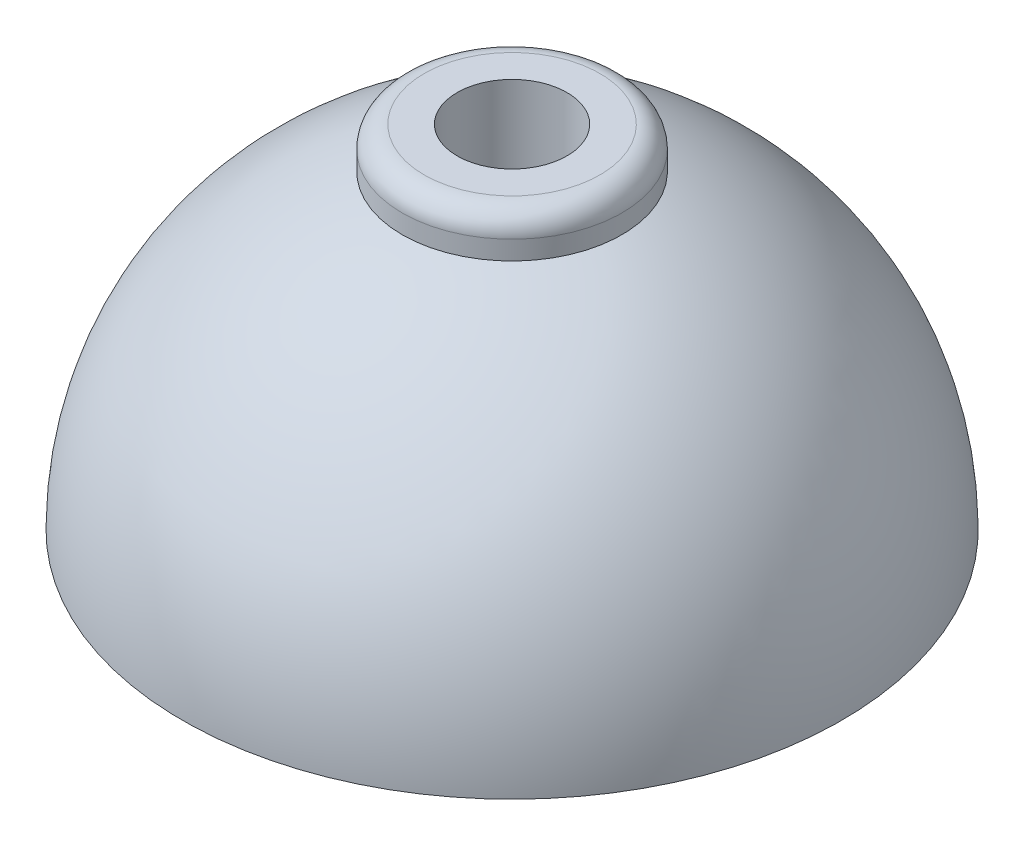
from build123d import *

# Parameters (mm, degrees)
SHELL1_T                 = -2
BOSS_EXTRUDE6_DEPTH      = 1
BOSS_EXTRUDE6_DEPTH_BACK = 5
SKETCH4_R                = 5
SKETCH2_R                = 2.5
CUT_EXTRUDE3_DEPTH       = 27.570660511
FILLET1_R                = 1


with BuildPart() as part:
    # Sketch1 → Revolve1 (revolve)
    with BuildSketch(Plane.XY):
        with BuildLine():
            Line((0, 0), (15, 0))
            ThreePointArc((15, 0), (10.606601718, 10.606601718), (0, 15))
            Line((0, 15), (0, 0))
        make_face()
    revolve(axis=Axis((0, 0, 0), (0, 1, 0)))

    # Shell1
    shell1_openings = [part.faces().sort_by_distance(p)[0] for p in [
        (0, 0, 0),
    ]]
    offset(amount=SHELL1_T, openings=shell1_openings, kind=Kind.INTERSECTION)

    # Sketch4 → Boss-Extrude6 (add, two sides: drawn at the far end of the back side and taken through both)
    with BuildSketch(Plane(origin=(0, 15, 0), x_dir=(1, 0, 0), z_dir=(0, 1, 0)).offset(-BOSS_EXTRUDE6_DEPTH_BACK)):
        with Locations(Location((0, 0, 0), (0, 0, 270))):
            Circle(SKETCH4_R)
    extrude(amount=BOSS_EXTRUDE6_DEPTH + BOSS_EXTRUDE6_DEPTH_BACK)

    # Sketch2 → Cut-Extrude3 (cut, through all)
    with BuildSketch(Plane(origin=(0, 0, 0), x_dir=(1, 0, 0), z_dir=(0, 1, 0))):
        with Locations(Location((0, 0, 0), (0, 0, 270))):
            Circle(SKETCH2_R)
    extrude(amount=CUT_EXTRUDE3_DEPTH, mode=Mode.SUBTRACT)

    # Fillet1
    fillet1_edges = [part.edges().sort_by_distance(p)[0] for p in [
        (0, 16, -5),
    ]]
    fillet(fillet1_edges, radius=FILLET1_R)


solid = part.part
